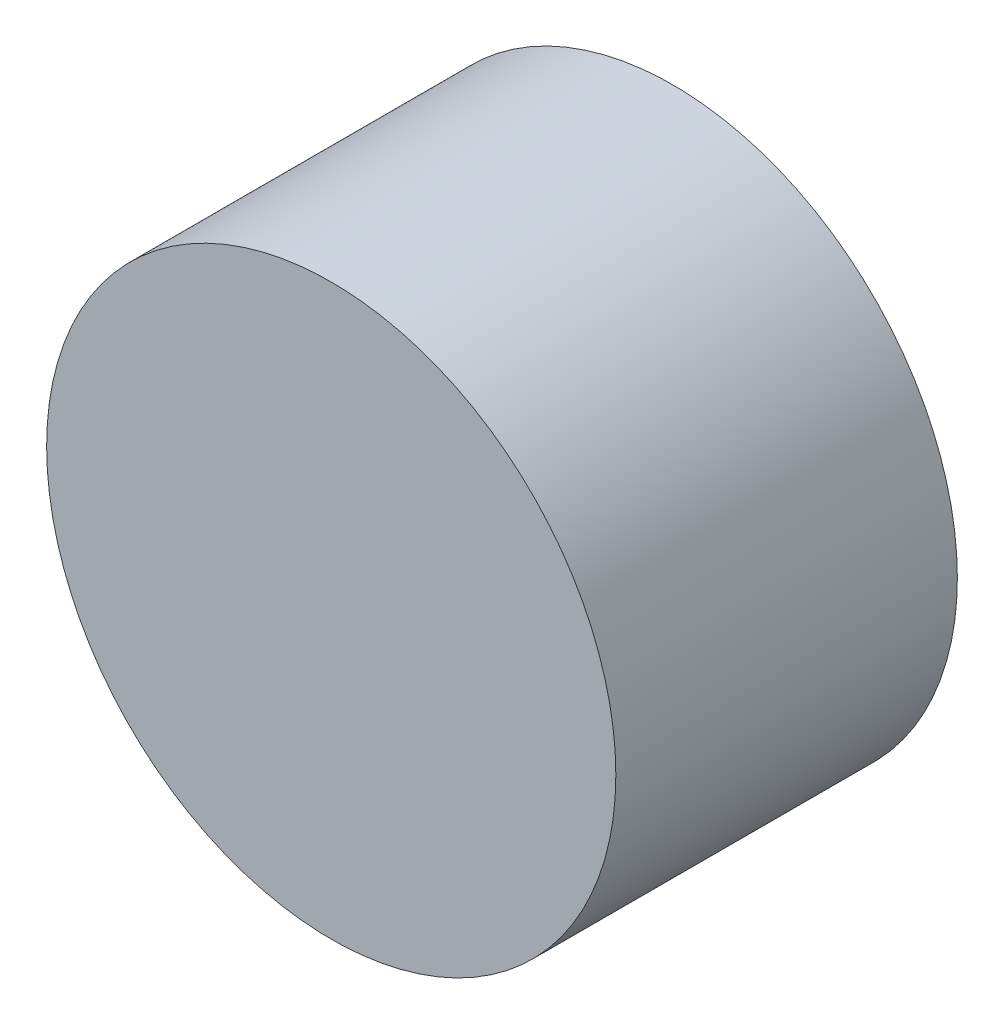
from build123d import *

# Parameters (mm, degrees)
SKETCH1_R           = 2.5
BOSS_EXTRUDE1_DEPTH = 3


with BuildPart() as part:
    # Sketch1 → Boss-Extrude1 (new body)
    with BuildSketch(Plane.XY):
        with Locations((-24.6, 10.844230831)):
            Circle(SKETCH1_R)
    extrude(amount=-BOSS_EXTRUDE1_DEPTH)


solid = part.part
